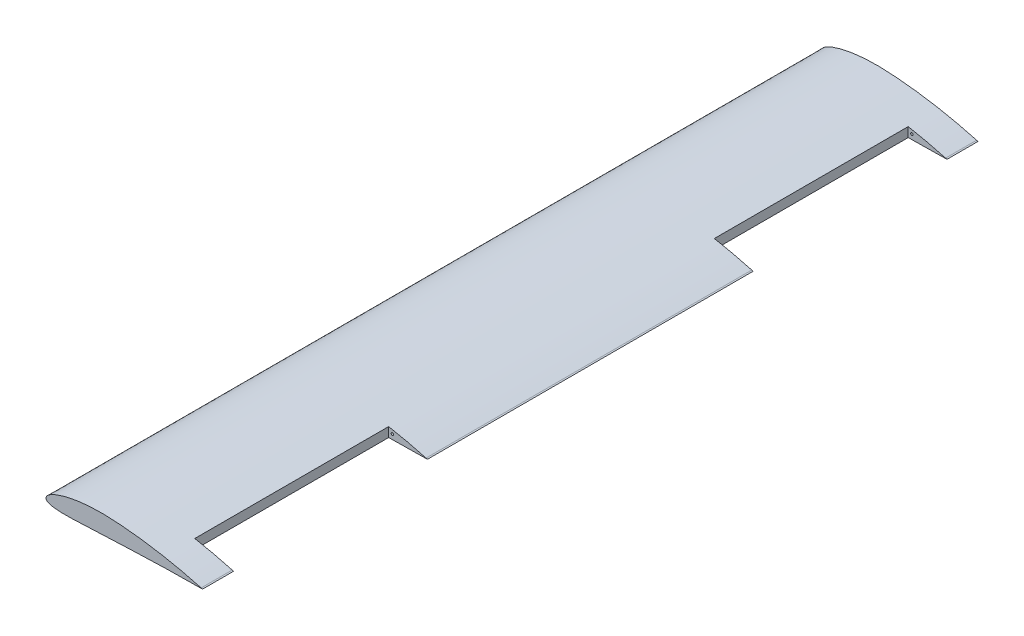
from build123d import *

# Parameters (mm, degrees)
BOSS_EXTRUDE1_DEPTH = 625
SKETCH2_W           = 62.5
SKETCH2_H           = 312.5
CUT_EXTRUDE1_DEPTH  = 675.443441489
SKETCH3_R           = 2
CUT_EXTRUDE2_DEPTH  = 30
CUT_EXTRUDE3_START  = -30
SKETCH4_R           = 2
CUT_EXTRUDE3_DEPTH  = 30


with BuildPart() as part:
    # Sketch1 → Boss-Extrude1 (new, symmetric)
    with BuildSketch(Plane.XY):
        with BuildLine():
            Line((250.04175, 0.31225), (252.265976181, -0.31225))
            Line((252.265976181, -0.31225), (249.95825, -0.31225))
            add(Edge.make_bspline(
                [(250.04175, 0.31225), (249.961003294, 0.334678558), (249.638433142, 0.424277052), (248.913630653, 0.624224417), (247.70876976, 0.955898409), (246.027493874, 1.413498532), (242.854101, 2.267948459), (239.068427279, 3.26267574), (234.682867149, 4.382287709), (230.741914115, 5.365189851), (226.38472416, 6.423213472), (221.627408788, 7.54501227), (216.487014456, 8.717718539), (210.982866052, 9.93013961), (205.134986611, 11.167599801), (198.965805067, 12.419523731), (192.498244433, 13.671302545), (185.757017198, 14.910830435), (178.768209981, 16.126653759), (171.558494234, 17.304790396), (164.156158366, 18.434981928), (156.590028524, 19.50485426), (148.890105577, 20.503858758), (141.086876898, 21.420856356), (133.211595312, 22.246783019), (125.295950784, 22.972070238), (117.372214656, 23.588774505), (109.472612316, 24.087616791), (101.597189103, 24.470407547), (93.768102422, 24.706608936), (86.018013855, 24.735628393), (78.4146885, 24.570329618), (71.000792285, 24.212499265), (63.809901877, 23.667705477), (56.874421802, 22.946148233), (50.225679474, 22.058380539), (43.893256226, 21.018203344), (37.905121679, 19.84035845), (32.287121097, 18.542209478), (27.062965572, 17.141849917), (22.254215959, 15.65825688), (17.879832416, 14.110777474), (13.955880211, 12.519648903), (10.496329385, 10.903159071), (7.511909249, 9.279653183), (5.010579107, 7.665272851), (2.996572739, 6.073523209), (1.470992765, 4.512245964), (0.433822111, 2.980628151), (-0.100976133, 1.463768075), (-0.087832316, -0.017621755), (0.469008038, -1.388866501), (1.53564055, -2.584859073), (3.057198898, -3.611975434), (5.023175998, -4.495536343), (7.429444849, -5.247584229), (10.269631678, -5.872972262), (13.533298286, -6.376065484), (17.207342678, -6.760926379), (21.276785933, -7.032448314), (25.725104739, -7.197828199), (30.534800779, -7.262834568), (35.687313616, -7.237466484), (41.163556019, -7.129994752), (46.943713537, -6.951500376), (53.007518466, -6.71302723), (59.333893652, -6.427427609), (65.901522492, -6.106652309), (72.688213468, -5.764199174), (79.671508058, -5.413374234), (86.827940266, -5.067757165), (94.142018966, -4.736908084), (101.621937783, -4.445736635), (109.238768021, -4.149145854), (116.954931472, -3.831852682), (124.708648979, -3.509247566), (132.47047333, -3.187158693), (140.210554571, -2.871302237), (147.899167526, -2.567391246), (155.506304968, -2.279609985), (163.002205998, -2.011019826), (170.357305924, -1.764507805), (177.542316018, -1.540478167), (184.528597215, -1.340459915), (191.287878299, -1.163839048), (197.792750381, -1.010188217), (204.016606552, -0.877377107), (209.93381186, -0.765321433), (215.519917328, -0.670667052), (220.751603169, -0.592005122), (225.607039712, -0.527759873), (230.065551846, -0.47532464), (234.108229565, -0.43326684), (237.717650747, -0.399446242), (240.878324021, -0.373313142), (243.576495431, -0.353202102), (245.800496536, -0.337649969), (247.540498054, -0.326440718), (248.788915206, -0.318831588), (249.540083938, -0.31477068), (249.874583358, -0.312754337), (249.95825, -0.31225)],
                knots=[0, 0, 0, 0, 0.00049114, 0.001962026, 0.004406441, 0.007815002, 0.012173731, 0.023666751, 0.030754195, 0.03869996, 0.047470457, 0.057031796, 0.067345089, 0.078369975, 0.090062358, 0.102375665, 0.115261553, 0.128668992, 0.142544999, 0.156834627, 0.171481882, 0.186428999, 0.20161683, 0.216985201, 0.232474114, 0.248022541, 0.26356855, 0.279050795, 0.294409506, 0.309776014, 0.324950676, 0.339824564, 0.354341727, 0.368445782, 0.382082852, 0.395201613, 0.407751475, 0.419686064, 0.430961955, 0.441537443, 0.451376776, 0.460447412, 0.468722555, 0.476182576, 0.482814922, 0.488618664, 0.493609655, 0.497829925, 0.501364694, 0.504371831, 0.507112525, 0.509853115, 0.512854813, 0.516367769, 0.520539593, 0.525445047, 0.531118393, 0.537568298, 0.54478829, 0.552761791, 0.561466343, 0.570873121, 0.580950015, 0.591662174, 0.602972463, 0.614840809, 0.627226871, 0.640086431, 0.653376876, 0.66705154, 0.681064304, 0.695366713, 0.709960022, 0.724934164, 0.740039735, 0.755219531, 0.770414901, 0.785567805, 0.800618776, 0.815509934, 0.830182038, 0.844577389, 0.858639376, 0.872310909, 0.885537901, 0.898266278, 0.910443942, 0.922021684, 0.932950823, 0.943186535, 0.952685933, 0.961409058, 0.969317876, 0.976379715, 0.982563346, 0.987841939, 0.992193049, 0.995597639, 0.998039598, 0.999509655, 1, 1, 1, 1], degree=3))
        make_face()
    extrude(amount=BOSS_EXTRUDE1_DEPTH, both=True)

    # Sketch2 → Cut-Extrude1 (cut, symmetric)
    with BuildSketch(Plane(origin=(0, 0, 0), x_dir=(1, 0, 0), z_dir=(0, 1, 0))):
        with Locations((221.015976181, -418.75)):
            Rectangle(SKETCH2_W, SKETCH2_H)
    cut_extrude1 = extrude(amount=CUT_EXTRUDE1_DEPTH, both=True, mode=Mode.SUBTRACT)

    # Sketch3 → Cut-Extrude2 (cut)
    with BuildSketch(Plane.XY.offset(262.5)):
        with Locations((195.765976181, 6.68775)):
            Circle(SKETCH3_R)
    cut_extrude2 = extrude(amount=-CUT_EXTRUDE2_DEPTH, mode=Mode.SUBTRACT)

    # Sketch4 → Cut-Extrude3 (cut)
    with BuildSketch(Plane(origin=(0, 0, 575), x_dir=(-1, 0, 0), z_dir=(0, 0, -1)).offset(CUT_EXTRUDE3_START)):
        with Locations(Location((-195.765976181, 6.68775, 0), (0, 0, 180))):
            Circle(SKETCH4_R)
    cut_extrude3 = extrude(amount=CUT_EXTRUDE3_DEPTH, mode=Mode.SUBTRACT)

    # Mirror1: Cut-Extrude1, Cut-Extrude2, Cut-Extrude3 across plane
    add(cut_extrude1.mirror(Plane.XY), mode=Mode.SUBTRACT)
    add(cut_extrude2.mirror(Plane.XY), mode=Mode.SUBTRACT)
    add(cut_extrude3.mirror(Plane.XY), mode=Mode.SUBTRACT)


solid = part.part
